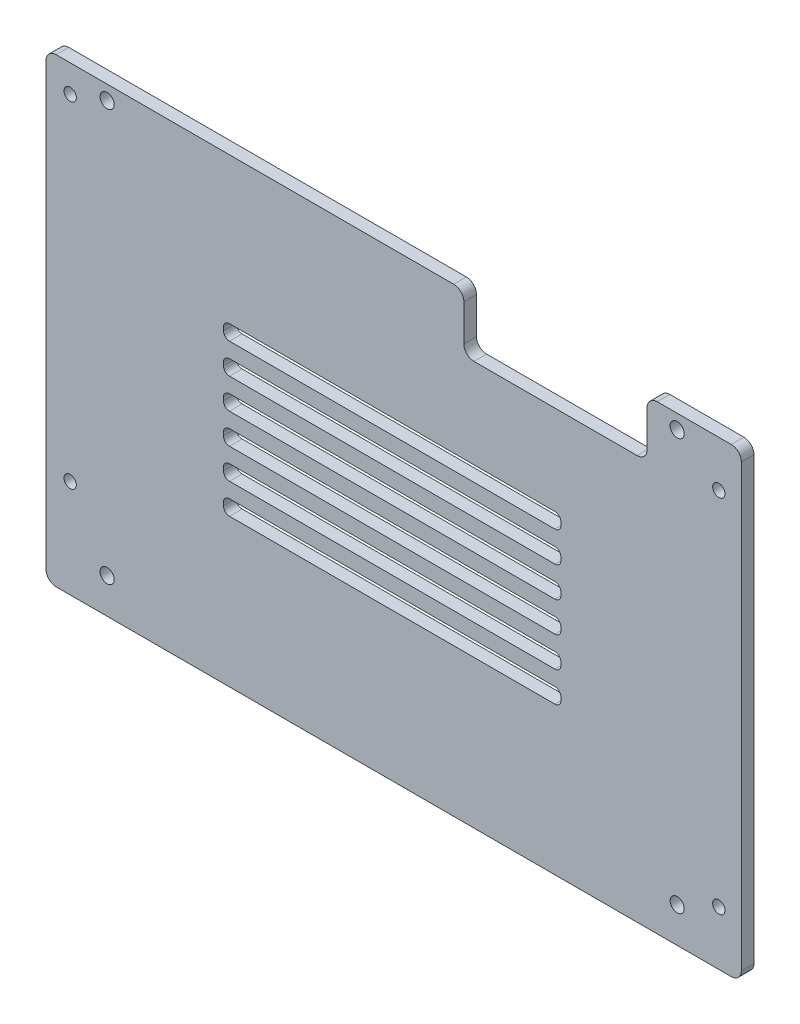
from build123d import *

# Parameters (mm, degrees)
SKETCH1_R           = 1.5494
SKETCH1_R_2         = 1.778
BOSS_EXTRUDE1_DEPTH = 3.175
FILLET2_R           = 2.54
FILLET3_R           = 2.54


with BuildPart() as part:
    # Sketch1 → Boss-Extrude1 (new body)
    with BuildSketch(Plane.XY):
        Polygon((0.381, 116.2304), (105.391042757, 116.2304), (105.391042757, 101.985486737), (151.460414906, 101.985486737), (151.460414906, 116.2304), (175.133, 116.2304), (175.133, 0.4064), (0.381, 0.4064), align=None)
        with Locations((6.4516, 109.3724)):
            Circle(SKETCH1_R, mode=Mode.SUBTRACT)
        with Locations((169.4688, 104.6734)):
            Circle(SKETCH1_R, mode=Mode.SUBTRACT)
        with Locations((169.4688, 14.0208)):
            Circle(SKETCH1_R, mode=Mode.SUBTRACT)
        with Locations((6.4516, 25.0952)):
            Circle(SKETCH1_R, mode=Mode.SUBTRACT)
        with Locations((15.748, 112.649)):
            Circle(SKETCH1_R_2, mode=Mode.SUBTRACT)
        with Locations((159.004, 112.649)):
            Circle(SKETCH1_R_2, mode=Mode.SUBTRACT)
        with Locations((15.748, 9.271)):
            Circle(SKETCH1_R_2, mode=Mode.SUBTRACT)
        with Locations(Location((159.004, 9.271, 0), (0, 0, 180))):
            Circle(SKETCH1_R_2, mode=Mode.SUBTRACT)
        with BuildLine():
            Line((44.96589092, 70.321337511), (44.96589092, 69.559337511))
            ThreePointArc((44.96589092, 69.559337511), (45.412260185, 68.481706777), (46.48989092, 68.035337511))
            Line((46.48989092, 68.035337511), (128.26210908, 68.035337511))
            ThreePointArc((128.26210908, 68.035337511), (129.339739815, 68.481706777), (129.78610908, 69.559337511))
            Line((129.78610908, 69.559337511), (129.78610908, 70.321337511))
            ThreePointArc((129.78610908, 70.321337511), (129.339739815, 71.398968246), (128.26210908, 71.845337511))
            Line((128.26210908, 71.845337511), (46.48989092, 71.845337511))
            ThreePointArc((46.48989092, 71.845337511), (45.412260185, 71.398968246), (44.96589092, 70.321337511))
        make_face(mode=Mode.SUBTRACT)
        with BuildLine():
            Line((46.48989092, 79.465337511), (128.26210908, 79.465337511))
            ThreePointArc((128.26210908, 79.465337511), (129.339739815, 79.018968246), (129.78610908, 77.941337511))
            Line((129.78610908, 77.941337511), (129.78610908, 77.179337511))
            ThreePointArc((129.78610908, 77.179337511), (129.339739815, 76.101706777), (128.26210908, 75.655337511))
            Line((128.26210908, 75.655337511), (46.48989092, 75.655337511))
            ThreePointArc((46.48989092, 75.655337511), (45.412260185, 76.101706777), (44.96589092, 77.179337511))
            Line((44.96589092, 77.179337511), (44.96589092, 77.941337511))
            ThreePointArc((44.96589092, 77.941337511), (45.412260185, 79.018968246), (46.48989092, 79.465337511))
        make_face(mode=Mode.SUBTRACT)
        with BuildLine():
            Line((44.96589092, 62.701337511), (44.96589092, 61.939337511))
            ThreePointArc((44.96589092, 61.939337511), (45.412260185, 60.861706777), (46.48989092, 60.415337511))
            Line((46.48989092, 60.415337511), (128.26210908, 60.415337511))
            ThreePointArc((128.26210908, 60.415337511), (129.339739815, 60.861706777), (129.78610908, 61.939337511))
            Line((129.78610908, 61.939337511), (129.78610908, 62.701337511))
            ThreePointArc((129.78610908, 62.701337511), (129.339739815, 63.778968246), (128.26210908, 64.225337511))
            Line((128.26210908, 64.225337511), (46.48989092, 64.225337511))
            ThreePointArc((46.48989092, 64.225337511), (45.412260185, 63.778968246), (44.96589092, 62.701337511))
        make_face(mode=Mode.SUBTRACT)
        with BuildLine():
            Line((44.96589092, 55.081337511), (44.96589092, 54.319337511))
            ThreePointArc((44.96589092, 54.319337511), (45.412260185, 53.241706777), (46.48989092, 52.795337511))
            Line((46.48989092, 52.795337511), (128.26210908, 52.795337511))
            ThreePointArc((128.26210908, 52.795337511), (129.339739815, 53.241706777), (129.78610908, 54.319337511))
            Line((129.78610908, 54.319337511), (129.78610908, 55.081337511))
            ThreePointArc((129.78610908, 55.081337511), (129.339739815, 56.158968246), (128.26210908, 56.605337511))
            Line((128.26210908, 56.605337511), (46.48989092, 56.605337511))
            ThreePointArc((46.48989092, 56.605337511), (45.412260185, 56.158968246), (44.96589092, 55.081337511))
        make_face(mode=Mode.SUBTRACT)
        with BuildLine():
            Line((44.96589092, 47.461337511), (44.96589092, 46.699337511))
            ThreePointArc((44.96589092, 46.699337511), (45.412260185, 45.621706777), (46.48989092, 45.175337511))
            Line((46.48989092, 45.175337511), (128.26210908, 45.175337511))
            ThreePointArc((128.26210908, 45.175337511), (129.339739815, 45.621706777), (129.78610908, 46.699337511))
            Line((129.78610908, 46.699337511), (129.78610908, 47.461337511))
            ThreePointArc((129.78610908, 47.461337511), (129.339739815, 48.538968246), (128.26210908, 48.985337511))
            Line((128.26210908, 48.985337511), (46.48989092, 48.985337511))
            ThreePointArc((46.48989092, 48.985337511), (45.412260185, 48.538968246), (44.96589092, 47.461337511))
        make_face(mode=Mode.SUBTRACT)
        with BuildLine():
            Line((44.96589092, 39.841337511), (44.96589092, 39.079337511))
            ThreePointArc((44.96589092, 39.079337511), (45.412260185, 38.001706777), (46.48989092, 37.555337511))
            Line((46.48989092, 37.555337511), (128.26210908, 37.555337511))
            ThreePointArc((128.26210908, 37.555337511), (129.339739815, 38.001706777), (129.78610908, 39.079337511))
            Line((129.78610908, 39.079337511), (129.78610908, 39.841337511))
            ThreePointArc((129.78610908, 39.841337511), (129.339739815, 40.918968246), (128.26210908, 41.365337511))
            Line((128.26210908, 41.365337511), (46.48989092, 41.365337511))
            ThreePointArc((46.48989092, 41.365337511), (45.412260185, 40.918968246), (44.96589092, 39.841337511))
        make_face(mode=Mode.SUBTRACT)
    extrude(amount=BOSS_EXTRUDE1_DEPTH)

    # Fillet2
    fillet2_edges = [part.edges().sort_by_distance(p)[0] for p in [
        (105.391042757, 116.2304, 1.5875),
        (105.391042757, 101.985486737, 1.5875),
        (151.460414906, 101.985486737, 1.5875),
        (151.460414906, 116.2304, 1.5875),
    ]]
    fillet(fillet2_edges, radius=FILLET2_R)

    # Fillet3
    fillet3_edges = [part.edges().sort_by_distance(p)[0] for p in [
        (0.381, 116.2304, 1.5875),
        (175.133, 116.2304, 1.5875),
        (175.133, 0.4064, 1.5875),
        (0.381, 0.4064, 1.5875),
    ]]
    fillet(fillet3_edges, radius=FILLET3_R)


solid = part.part
